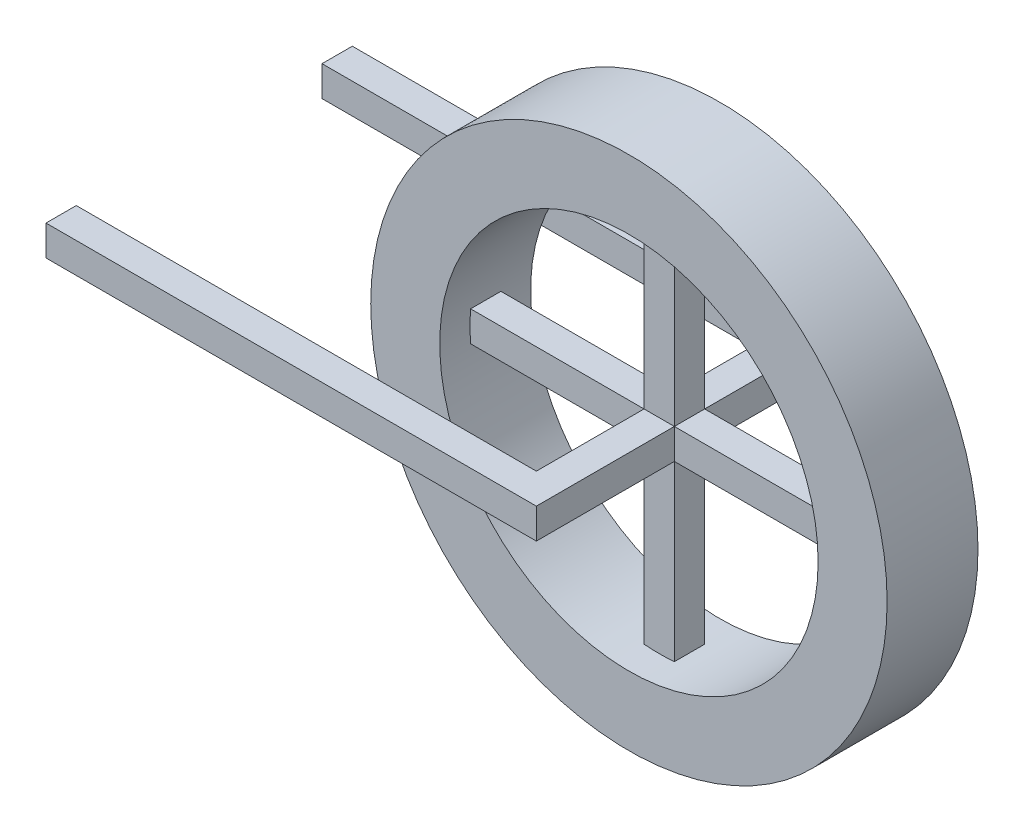
from build123d import *

# Parameters (mm, degrees)
ESQUISSE1_R                         = 56.125
ESQUISSE1_R_2                       = 41.125
BOSS_EXTRU_1_DEPTH                  = 19.75
BOSS_EXTRU_2_REACH                  = 83.793
BOSS_EXTRU_2_END_RADIUS             = 41.125
ESQUISSE2_W                         = 6.583333334
ESQUISSE2_H                         = 6.583333334
BOSS_EXTRU_2_DIRECTION_2_REACH      = 83.793
BOSS_EXTRU_2_DIRECTION_2_END_RADIUS = 41.125
R_P_TITION_CIRCULAIRE1_COUNT        = 2
R_P_TITION_CIRCULAIRE1_ANGLE        = 90
ESQUISSE5_W                         = 6.583333334
ESQUISSE5_H                         = 6.583333334
BOSS_EXTRU_3_DEPTH                  = 30
ESQUISSE6_W                         = 6.583333334
ESQUISSE6_H                         = 6.583333334
BOSS_EXTRU_4_DEPTH                  = 100


with BuildPart() as part:
    # Esquisse1 → Boss.-Extru.1 (new body)
    with BuildSketch(Plane.XY):
        Circle(ESQUISSE1_R)
        Circle(ESQUISSE1_R_2, mode=Mode.SUBTRACT)
    extrude(amount=BOSS_EXTRU_1_DEPTH)

    # Boss.-Extru.2: up to this cylinder (the profile starts inside it)
    boss_extru_2_end = Plane(origin=(0, 0, 9.875), z_dir=(0, 0, -1)) * Cylinder(BOSS_EXTRU_2_END_RADIUS, 250.836, mode=Mode.PRIVATE)
    # Esquisse2 → Boss.-Extru.2 (add, up to the surface)
    with BuildSketch(Plane(origin=(0, 0, 0), x_dir=(0, 0, -1), z_dir=(1, 0, 0)), mode=Mode.PRIVATE) as boss_extru_2_sk1:
        with Locations((-9.875, 0)):
            Rectangle(ESQUISSE2_W, ESQUISSE2_H)
    boss_extru_2_tool1 = extrude(boss_extru_2_sk1.sketch, amount=BOSS_EXTRU_2_REACH, mode=Mode.PRIVATE) & boss_extru_2_end
    boss_extru_2 = boss_extru_2_tool1.solids().sort_by_distance((0, 0, 9.875))[0]
    add(boss_extru_2)

    # Boss.-Extru.2 direction 2: up to this cylinder (the profile starts inside it)
    boss_extru_2_direction_2_end = Plane(origin=(0, 0, 9.875), z_dir=(0, 0, -1)) * Cylinder(BOSS_EXTRU_2_DIRECTION_2_END_RADIUS, 250.836, mode=Mode.PRIVATE)
    # Esquisse2 → Boss.-Extru.2 direction 2 (add, up to the surface)
    with BuildSketch(Plane(origin=(0, 0, 0), x_dir=(0, 0, -1), z_dir=(1, 0, 0)), mode=Mode.PRIVATE) as boss_extru_2_direction_2_sk1:
        with Locations((-9.875, 0)):
            Rectangle(ESQUISSE2_W, ESQUISSE2_H)
    boss_extru_2_direction_2_tool1 = extrude(boss_extru_2_direction_2_sk1.sketch, amount=-BOSS_EXTRU_2_DIRECTION_2_REACH, mode=Mode.PRIVATE) & boss_extru_2_direction_2_end
    boss_extru_2_direction_2 = boss_extru_2_direction_2_tool1.solids().sort_by_distance((0, 0, 9.875))[0]
    add(boss_extru_2_direction_2)
    boss_extru_2 = boss_extru_2 + boss_extru_2_direction_2  # both directions under the feature's name, for the pattern or mirror that repeats it

    # Répétition circulaire1: Boss.-Extru.2 ×2 about axis
    r_p_tition_circulaire1_axis = Axis((0, 0, 32.118593888), (0, 0, -1))
    for i in range(1, R_P_TITION_CIRCULAIRE1_COUNT):
        add(boss_extru_2.rotate(r_p_tition_circulaire1_axis, i * R_P_TITION_CIRCULAIRE1_ANGLE / (R_P_TITION_CIRCULAIRE1_COUNT - 1)))

    # Esquisse5 → Boss.-Extru.3 (add)
    with BuildSketch(Plane(origin=(0, 0, 6.583333333), x_dir=(-1, 0, 0), z_dir=(0, 0, -1))):
        Rectangle(ESQUISSE5_W, ESQUISSE5_H)
    boss_extru_3 = extrude(amount=BOSS_EXTRU_3_DEPTH)

    # Esquisse6 → Boss.-Extru.4 (add)
    with BuildSketch(Plane.ZY.offset(3.291666667)):
        with Locations((-20.125, 0)):
            Rectangle(ESQUISSE6_W, ESQUISSE6_H)
    boss_extru_4 = extrude(amount=BOSS_EXTRU_4_DEPTH)

    # Symétrie1: Boss.-Extru.3, Boss.-Extru.4 across plane
    add(boss_extru_3.mirror(Plane(origin=(0, 0, 9.875), x_dir=(1, 0, 0), z_dir=(0, 0, -1))))
    add(boss_extru_4.mirror(Plane(origin=(0, 0, 9.875), x_dir=(1, 0, 0), z_dir=(0, 0, -1))))


solid = part.part
